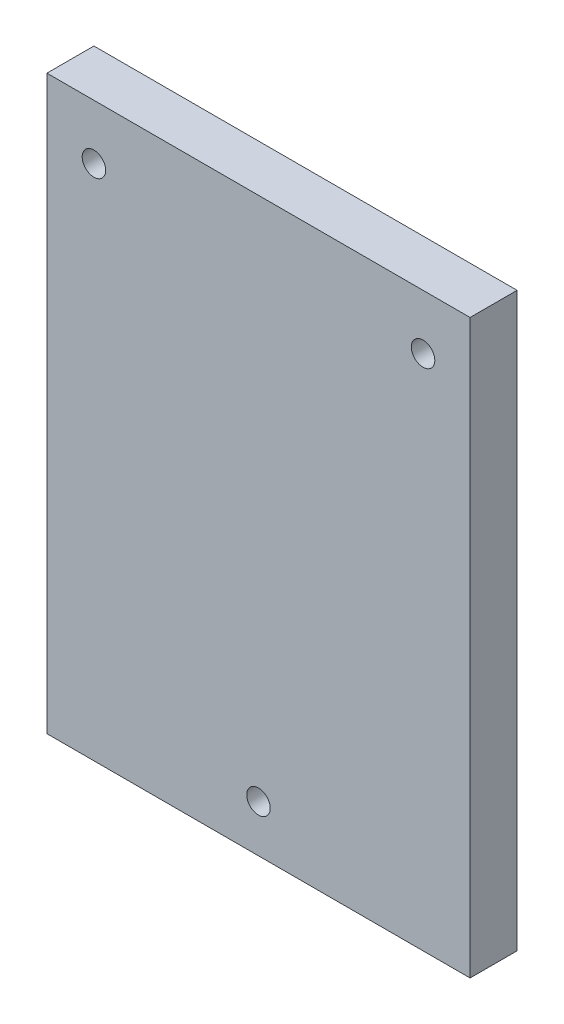
from build123d import *

# Parameters (mm, degrees)
SKETCH_1_W      = 54
SKETCH_1_H      = 73
SKETCH_1_R      = 1.5
EXTRUDE_1_DEPTH = 6


with BuildPart() as part:
    # Эскиз1 → Бобышка-Вытянуть1 (new body)
    with BuildSketch(Plane.XY):
        with Locations((44.275, -36.5)):
            Rectangle(SKETCH_1_W, SKETCH_1_H)
        with Locations((44.275, -67)):
            Circle(SKETCH_1_R, mode=Mode.SUBTRACT)
        with Locations((65.275, -7)):
            Circle(SKETCH_1_R, mode=Mode.SUBTRACT)
        with Locations((23.275, -7)):
            Circle(SKETCH_1_R, mode=Mode.SUBTRACT)
    extrude(amount=EXTRUDE_1_DEPTH)


solid = part.part
